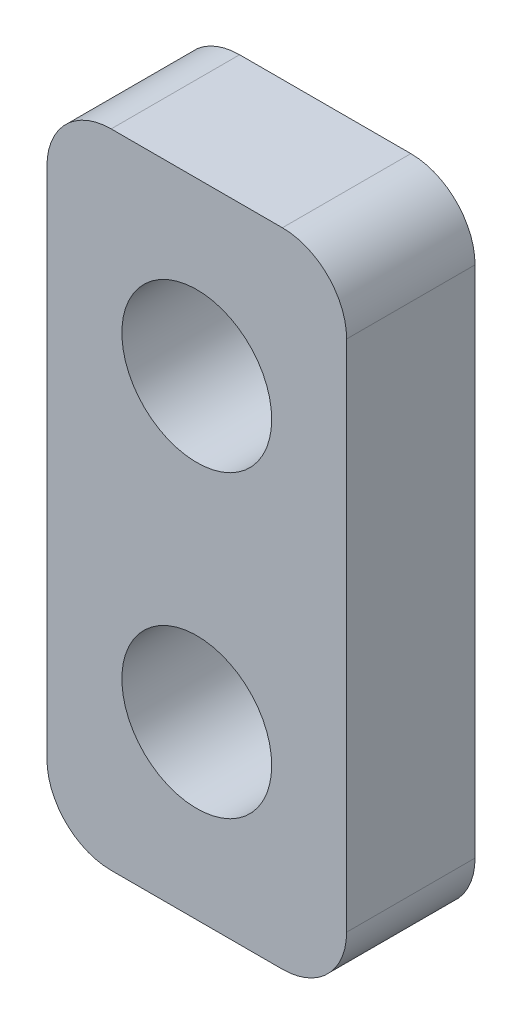
from build123d import *

# Parameters (mm, degrees)
SKETCH1_R           = 3.5
BOSS_EXTRUDE1_DEPTH = 6


with BuildPart() as part:
    # Sketch1 → Boss-Extrude1 (new body)
    with BuildSketch(Plane.XY):
        with BuildLine():
            Line((3, 0), (11, 0))
            ThreePointArc((11, 0), (13.121320344, 0.878679656), (14, 3))
            Line((14, 3), (14, 27))
            ThreePointArc((14, 27), (13.121320344, 29.121320344), (11, 30))
            Line((11, 30), (3, 30))
            ThreePointArc((3, 30), (0.878679656, 29.121320344), (0, 27))
            Line((0, 27), (0, 3))
            ThreePointArc((0, 3), (0.878679656, 0.878679656), (3, 0))
        make_face()
        with Locations((7, 22)):
            Circle(SKETCH1_R, mode=Mode.SUBTRACT)
        with Locations((7, 8)):
            Circle(SKETCH1_R, mode=Mode.SUBTRACT)
    extrude(amount=BOSS_EXTRUDE1_DEPTH)


solid = part.part
